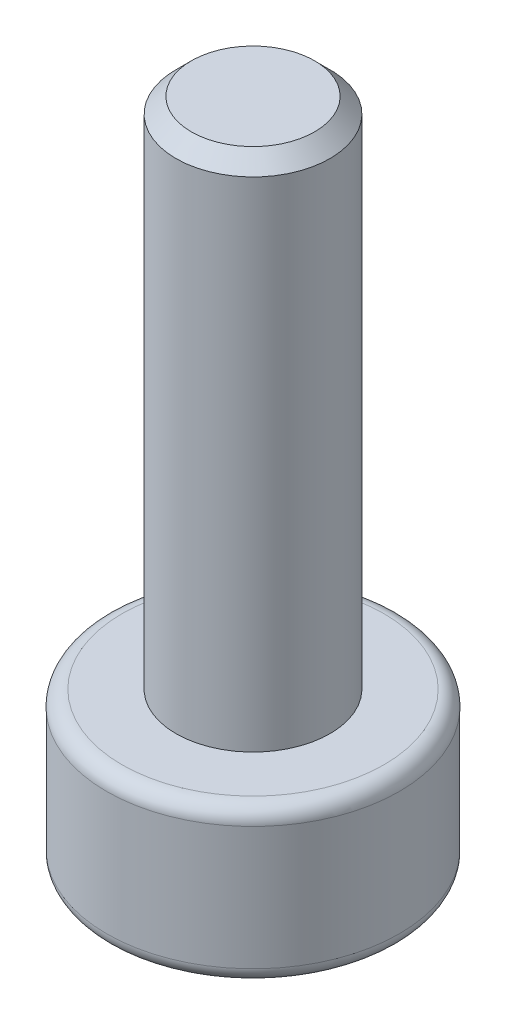
from build123d import *

# Parameters (mm, degrees)
SKETCH_1_R          = 2.85
EXTRUDE_1_DEPTH     = 3
SKETCH_2_R          = 1.5
EXTRUDE_2_DEPTH     = 10
SKETCH_3_R          = 1.29
CUT_EXTRUDE_1_DEPTH = 1.3
FILLET_1_R          = 0.3
CHAMFER_1_SIZE      = 0.3
CHAMFER_2_SIZE      = 0.15


with BuildPart() as part:
    # 草图1 → 凸台-拉伸1 (new body)
    with BuildSketch(Plane(origin=(0, 0, 0), x_dir=(1, 0, 0), z_dir=(0, 1, 0))):
        with Locations(Location((0, 0, 0), (0, 0, 270))):
            Circle(SKETCH_1_R)
    extrude(amount=EXTRUDE_1_DEPTH)

    # 草图2 → 凸台-拉伸2 (add)
    with BuildSketch(Plane(origin=(0, 3, 0), x_dir=(1, 0, 0), z_dir=(0, 1, 0))):
        with Locations(Location((0, 0, 0), (0, 0, 270))):
            Circle(SKETCH_2_R)
    extrude(amount=EXTRUDE_2_DEPTH)

    # 草图3 → 切除-拉伸1 (cut)
    with BuildSketch(Plane.XZ):
        with Locations(Location((0, 0, 0), (0, 0, 270))):
            Circle(SKETCH_3_R)
    extrude(amount=-CUT_EXTRUDE_1_DEPTH, mode=Mode.SUBTRACT)

    # 圆角1
    fillet_1_edges = [part.edges().sort_by_distance(p)[0] for p in [
        (0, 0, -2.85),
        (0, 3, -2.85),
    ]]
    fillet(fillet_1_edges, radius=FILLET_1_R)

    # 倒角1
    chamfer_1_edges = [part.edges().sort_by_distance(p)[0] for p in [
        (0, 13, -1.5),
    ]]
    chamfer(chamfer_1_edges, length=CHAMFER_1_SIZE)

    # 倒角2
    chamfer_2_edges = [part.edges().sort_by_distance(p)[0] for p in [
        (0, 0, 1.29),
    ]]
    chamfer(chamfer_2_edges, length=CHAMFER_2_SIZE)


solid = part.part
